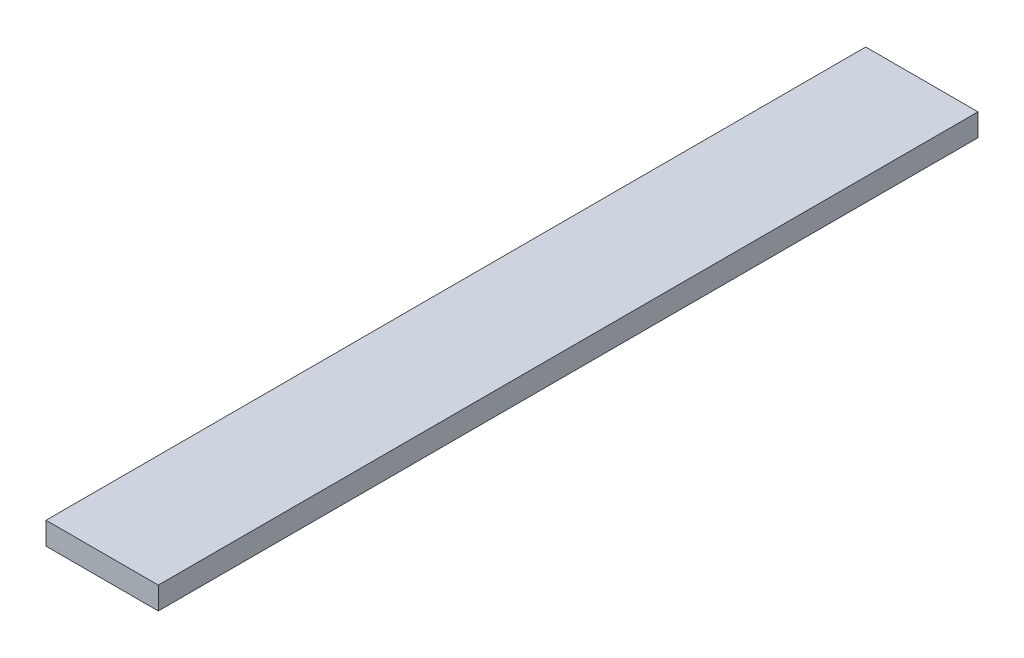
from build123d import *

# Parameters (mm, degrees)
SKETCH1_W           = 5
SKETCH1_H           = 36.5
BOSS_EXTRUDE1_DEPTH = 1


with BuildPart() as part:
    # Sketch1 → Boss-Extrude1 (new body)
    with BuildSketch(Plane(origin=(0, 0, 0), x_dir=(1, 0, 0), z_dir=(0, 1, 0))):
        Rectangle(SKETCH1_W, SKETCH1_H)
    extrude(amount=BOSS_EXTRUDE1_DEPTH)


solid = part.part
